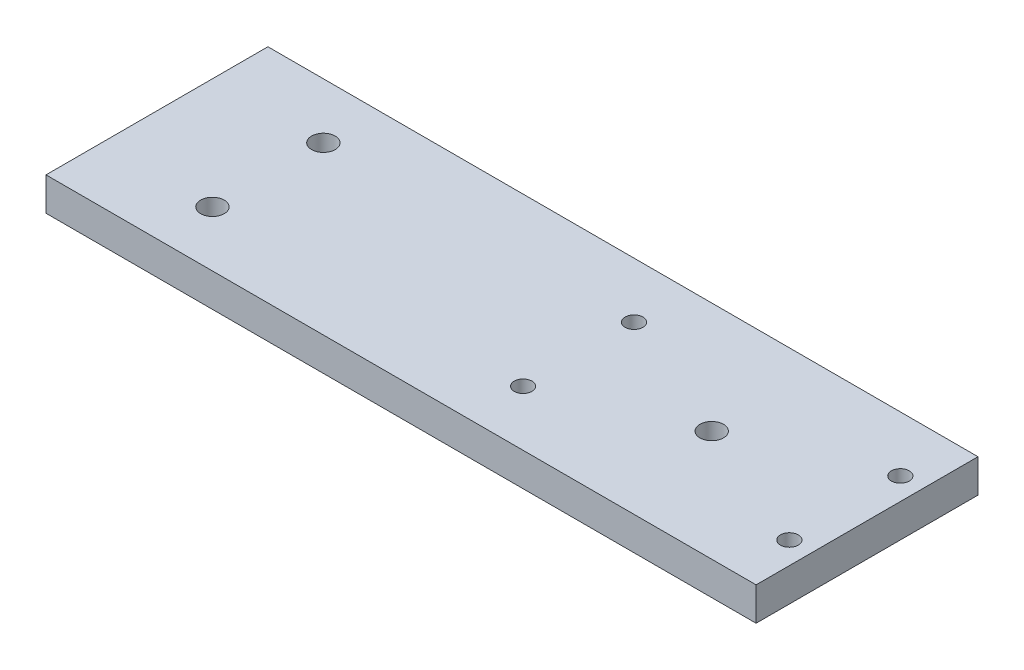
from build123d import *

# Parameters (mm, degrees)
SKETCH1_W               = 203.2
SKETCH1_H               = 63.5
BOSS_EXTRUDE1_DEPTH     = 9.525
F_10_CLEARANCE_HOLE1_D  = 5.1054
F_1_4_CLEARANCE_HOLE1_D = 6.7564
F_1_4_CLEARANCE_HOLE2_D = 6.7564


with BuildPart() as part:
    # Sketch1 → Boss-Extrude1 (new body)
    with BuildSketch(Plane(origin=(0, 0, 0), x_dir=(1, 0, 0), z_dir=(0, 1, 0))):
        Rectangle(SKETCH1_W, SKETCH1_H)
    extrude(amount=BOSS_EXTRUDE1_DEPTH)

    # #10 Clearance Hole1 (through all)
    with Locations(Plane(origin=(0, 0, 0), x_dir=(-1, 0, 0), z_dir=(0, -1, 0))):
        with Locations((-19.05, 15.875), (-95.25, 15.875), (-95.25, -15.875), (-19.05, -15.875)):
            Hole(F_10_CLEARANCE_HOLE1_D / 2)

    # 1/4 Clearance Hole1 (through all)
    with Locations(Plane(origin=(0, 0, 0), x_dir=(-1, 0, 0), z_dir=(0, -1, 0))):
        with Locations((-57.15, 0)):
            Hole(F_1_4_CLEARANCE_HOLE1_D / 2)

    # 1/4 Clearance Hole2 (through all)
    with Locations(Plane(origin=(0, 0, 0), x_dir=(-1, 0, 0), z_dir=(0, -1, 0))):
        with Locations((69.85, 15.875), (69.85, -15.875)):
            Hole(F_1_4_CLEARANCE_HOLE2_D / 2)


solid = part.part
